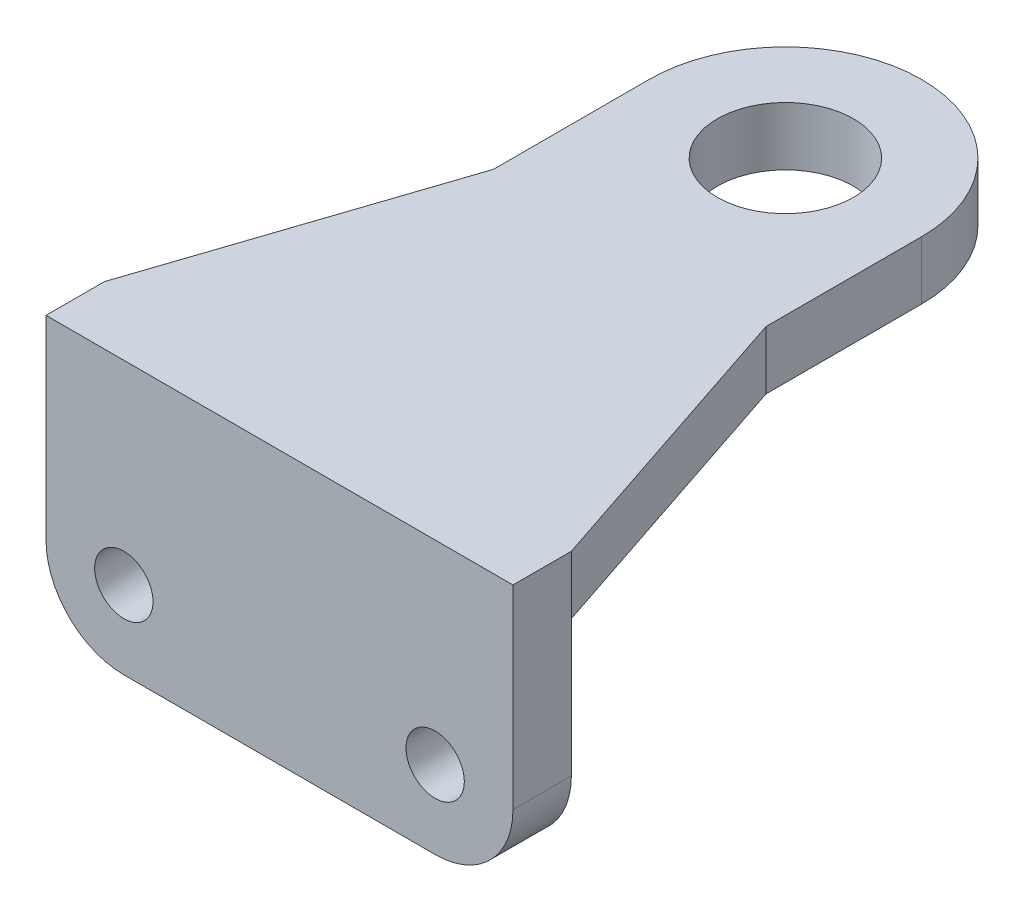
from build123d import *

# Parameters (mm, degrees)
IZIM1_R                     = 7.5
Y_KSEKLIK_EKSTR_ZYON1_DEPTH = 15
IZIM2_R                     = 17.5
Y_KSEKLIK_EKSTR_ZYON2_DEPTH = 15
FEDER1_REACH                = 174.399
IZIM4_WALL_W                = 417.508136348
IZIM4_WALL_H                = 10


with BuildPart() as part:
    # Çizim1 → Yükseklik-Ekstrüzyon1 (new body)
    with BuildSketch(Plane.XY):
        with BuildLine():
            Line((-142.056451613, 60.177419355), (-22.056451613, 60.177419355))
            Line((-22.056451613, 60.177419355), (-22.056451613, 10.177419355))
            ThreePointArc((-22.056451613, 10.177419355), (-27.914315989, -3.964716269), (-42.056451613, -9.822580645))
            Line((-42.056451613, -9.822580645), (-122.056451613, -9.822580645))
            ThreePointArc((-122.056451613, -9.822580645), (-136.198587237, -3.964716269), (-142.056451613, 10.177419355))
            Line((-142.056451613, 10.177419355), (-142.056451613, 60.177419355))
        make_face()
        with Locations((-122.056451613, 10.177419355)):
            Circle(IZIM1_R, mode=Mode.SUBTRACT)
        with Locations((-42.056451613, 10.177419355)):
            Circle(IZIM1_R, mode=Mode.SUBTRACT)
    extrude(amount=Y_KSEKLIK_EKSTR_ZYON1_DEPTH)

    # Çizim2 → Yükseklik-Ekstrüzyon2 (add)
    with BuildSketch(Plane(origin=(0, 60.177419355, 0), x_dir=(1, 0, 0), z_dir=(0, 1, 0))):
        with BuildLine():
            Line((-117.056451613, 115), (-117.056451613, 75))
            Line((-117.056451613, 75), (-142.056451613, 0))
            Line((-142.056451613, 0), (-22.056451613, 0))
            Line((-22.056451613, 0), (-47.056451613, 75))
            Line((-47.056451613, 75), (-47.056451613, 115))
            ThreePointArc((-47.056451613, 115), (-82.056451613, 150), (-117.056451613, 115))
        make_face()
        with Locations(Location((-82.056451613, 115, 0), (0, 0, 270))):
            Circle(IZIM2_R, mode=Mode.SUBTRACT)
    extrude(amount=-Y_KSEKLIK_EKSTR_ZYON2_DEPTH)

    # Çizim4 wall → Feder1 (add, up to next)
    with BuildSketch(Plane(origin=(-82.056451613, 20.177419355, -25), x_dir=(0, 0.707106781187, -0.707106781187), z_dir=(0, -0.707106781187, -0.707106781187)), mode=Mode.PRIVATE) as feder1_sk1:
        Rectangle(IZIM4_WALL_W, IZIM4_WALL_H)
    feder1_tool1 = extrude(feder1_sk1.sketch, amount=-FEDER1_REACH, mode=Mode.PRIVATE) - part.part
    add(feder1_tool1.solids().sort_by_distance((-82.056451613, 20.177419355, -25))[0])


solid = part.part
